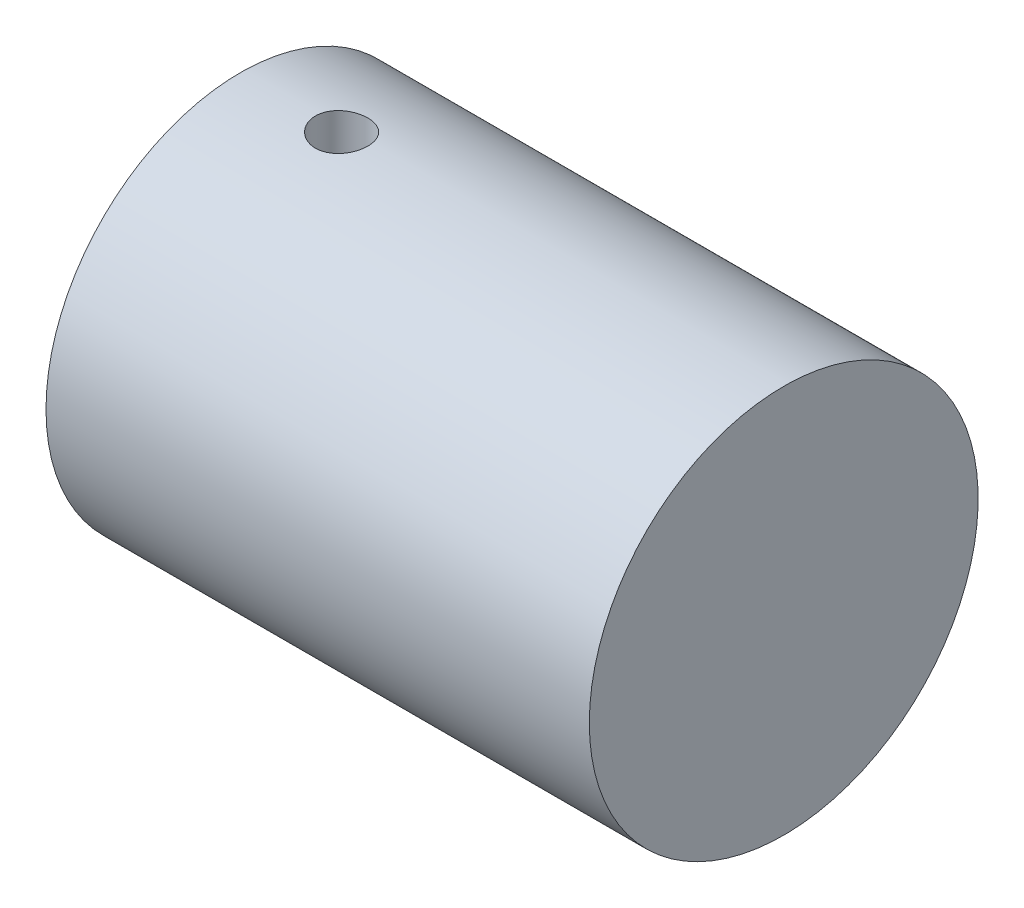
from build123d import *

# Parameters (mm, degrees)
ESQUISSE1_W                  = 51
ESQUISSE1_H                  = 18.25
ENL_V_MAT_EXTRU_1_DEPTH      = 50.55404417
ENL_V_MAT_EXTRU_1_DEPTH_BACK = 50.55404417
ESQUISSE2_R                  = 2.459


with BuildPart() as part:
    # Esquisse1 → Révolution1 (revolve)
    with BuildSketch(Plane.XY, mode=Mode.PRIVATE) as r_volution1_sk:
        with Locations((2.612111155, 9.125)):
            Rectangle(ESQUISSE1_W, ESQUISSE1_H)
    revolve(r_volution1_sk.sketch.rotate(Axis((-22.887888845, 0, 0), (1, 0, 0)), 90), axis=Axis((-22.887888845, 0, 0), (1, 0, 0)))

    # Esquisse2 → Enlèv. mat.-Extru.1 (cut, two sides: drawn at the far end of the back side and taken through both)
    with BuildSketch(Plane(origin=(0, 18.25, 0), x_dir=(1, 0, 0), z_dir=(0, 1, 0)).offset(-ENL_V_MAT_EXTRU_1_DEPTH_BACK)):
        with Locations(Location((-13.387888845, 0, 0), (0, 0, 270))):
            Circle(ESQUISSE2_R)
    extrude(amount=ENL_V_MAT_EXTRU_1_DEPTH + ENL_V_MAT_EXTRU_1_DEPTH_BACK, mode=Mode.SUBTRACT)


solid = part.part
